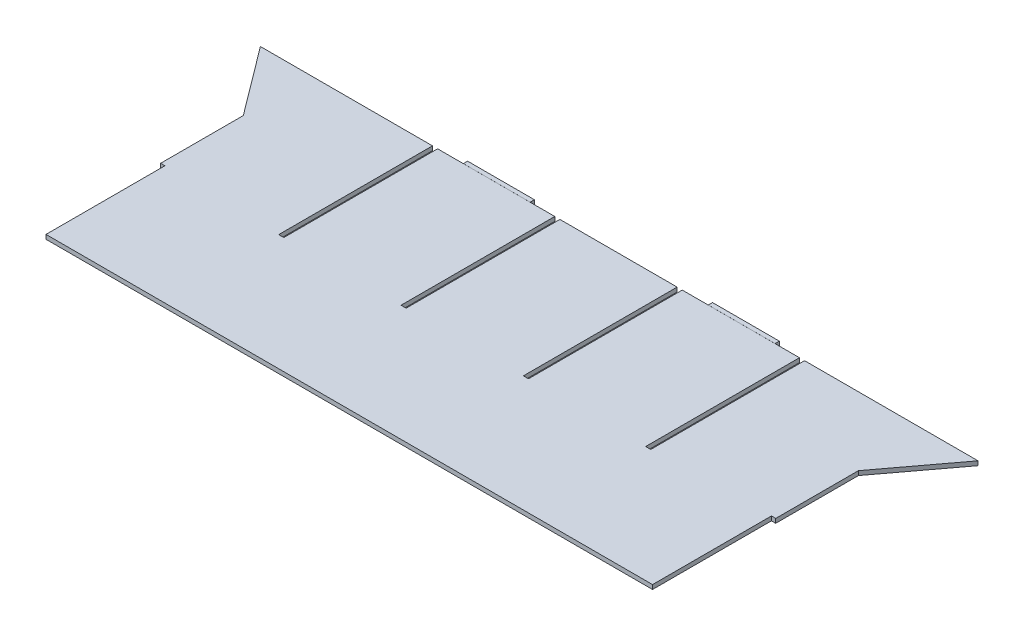
from build123d import *

# Parameters (mm, degrees)
SKETCH1_W           = 457.2020066
SKETCH1_H           = 3.175
BOSS_EXTRUDE1_DEPTH = 200.6419914
SKETCH2_W           = 3.81
SKETCH2_H           = 114.3
CUT_EXTRUDE1_DEPTH  = 305.180387349
LPATTERN1_COUNT     = 4
LPATTERN1_PITCH     = 90.932
BOSS_EXTRUDE3_DEPTH = 3.175
SKETCH5_W           = 3.175
SKETCH5_H           = 88.392
CUT_EXTRUDE2_DEPTH  = 3.175
SKETCH3_W           = 49.658811606
SKETCH3_H           = 3.175
BOSS_EXTRUDE4_DEPTH = 3.175


with BuildPart() as part:
    # Sketch1 → Boss-Extrude1 (new body)
    with BuildSketch(Plane.XY):
        Rectangle(SKETCH1_W, SKETCH1_H)
    extrude(amount=BOSS_EXTRUDE1_DEPTH)

    # Sketch2 → Cut-Extrude1 (cut, through all)
    with BuildSketch(Plane(origin=(0, 1.5875, 0), x_dir=(1, 0, 0), z_dir=(0, 1, 0))):
        with Locations((135.8910033, -57.15)):
            Rectangle(SKETCH2_W, SKETCH2_H)
    cut_extrude1 = extrude(amount=-CUT_EXTRUDE1_DEPTH, mode=Mode.SUBTRACT)

    # LPattern1: Cut-Extrude1 ×4
    with Locations(*[(-i * LPATTERN1_PITCH, 0, 0) for i in range(1, LPATTERN1_COUNT)]):
        add(cut_extrude1, mode=Mode.SUBTRACT)

    # Sketch4 → Boss-Extrude3 (add)
    with BuildSketch(Plane.XZ.offset(1.5875)):
        Polygon((-228.6010033, 0), (-266.7010033, 0), (-228.6010033, 50.8), align=None)
    boss_extrude3 = extrude(amount=-BOSS_EXTRUDE3_DEPTH)

    # Mirror1: Boss-Extrude3 across plane
    add(boss_extrude3.mirror(Plane(origin=(0, 0, 0), x_dir=(0, 0, 1), z_dir=(1, 0, 0))))

    # Sketch5 → Cut-Extrude2 (cut)
    with BuildSketch(Plane.XZ.offset(1.5875)):
        with Locations((-227.0135033, 156.4459914)):
            Rectangle(SKETCH5_W, SKETCH5_H)
    cut_extrude2 = extrude(amount=-CUT_EXTRUDE2_DEPTH, mode=Mode.SUBTRACT)

    # Mirror2: Cut-Extrude2 across plane
    add(cut_extrude2.mirror(Plane(origin=(0, 0, 0), x_dir=(0, 0, 1), z_dir=(1, 0, 0))), mode=Mode.SUBTRACT)

    # Sketch3 → Boss-Extrude4 (add)
    with BuildSketch(Plane(origin=(0, 0, 0), x_dir=(-1, 0, 0), z_dir=(0, 0, -1))):
        with Locations((-91.020094169, 0.029240406)):
            Rectangle(SKETCH3_W, SKETCH3_H)
        with Locations((91.020094169, 0.029240406)):
            Rectangle(SKETCH3_W, SKETCH3_H)
    extrude(amount=BOSS_EXTRUDE4_DEPTH)


solid = part.part
